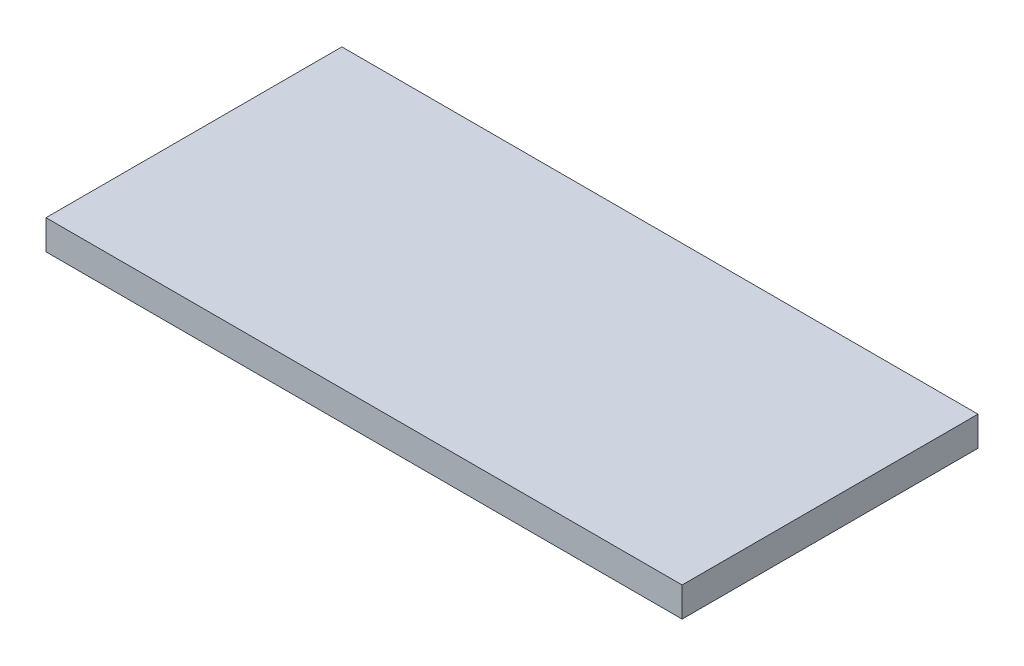
from build123d import *

# Parameters (mm, degrees)
SKETCH1_W           = 43
SKETCH1_H           = 20
BOSS_EXTRUDE1_DEPTH = 2


with BuildPart() as part:
    # Sketch1 → Boss-Extrude1 (new body)
    with BuildSketch(Plane(origin=(0, 0, 0), x_dir=(1, 0, 0), z_dir=(0, 1, 0))):
        with Locations((21.5, 10)):
            Rectangle(SKETCH1_W, SKETCH1_H)
    extrude(amount=BOSS_EXTRUDE1_DEPTH)


solid = part.part
